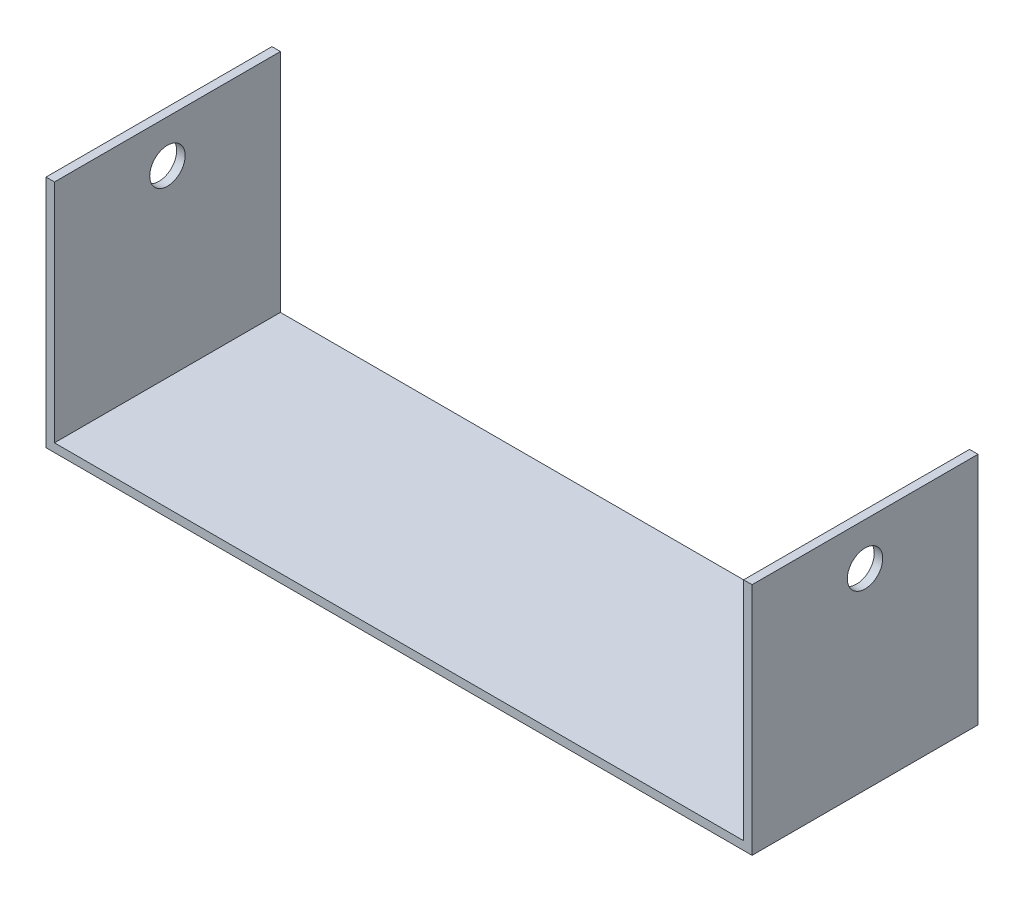
from build123d import *

# Parameters (mm, degrees)
BOSS_EXTRUDE1_DEPTH = 80
SKETCH2_R           = 6.272806616
CUT_EXTRUDE1_DEPTH  = 500


with BuildPart() as part:
    # Sketch1 → Boss-Extrude1 (new body)
    with BuildSketch(Plane.XY):
        Polygon((125, 0), (-125, 0), (-125, 83), (-122, 83), (-122, 3), (122, 3), (122, 83), (125, 83), align=None)
    extrude(amount=BOSS_EXTRUDE1_DEPTH)

    # Sketch2 → Cut-Extrude1 (cut)
    with BuildSketch(Plane.ZY.offset(125)):
        with Locations((40, 67.971243919)):
            Circle(SKETCH2_R)
    extrude(amount=-CUT_EXTRUDE1_DEPTH, mode=Mode.SUBTRACT)


solid = part.part
